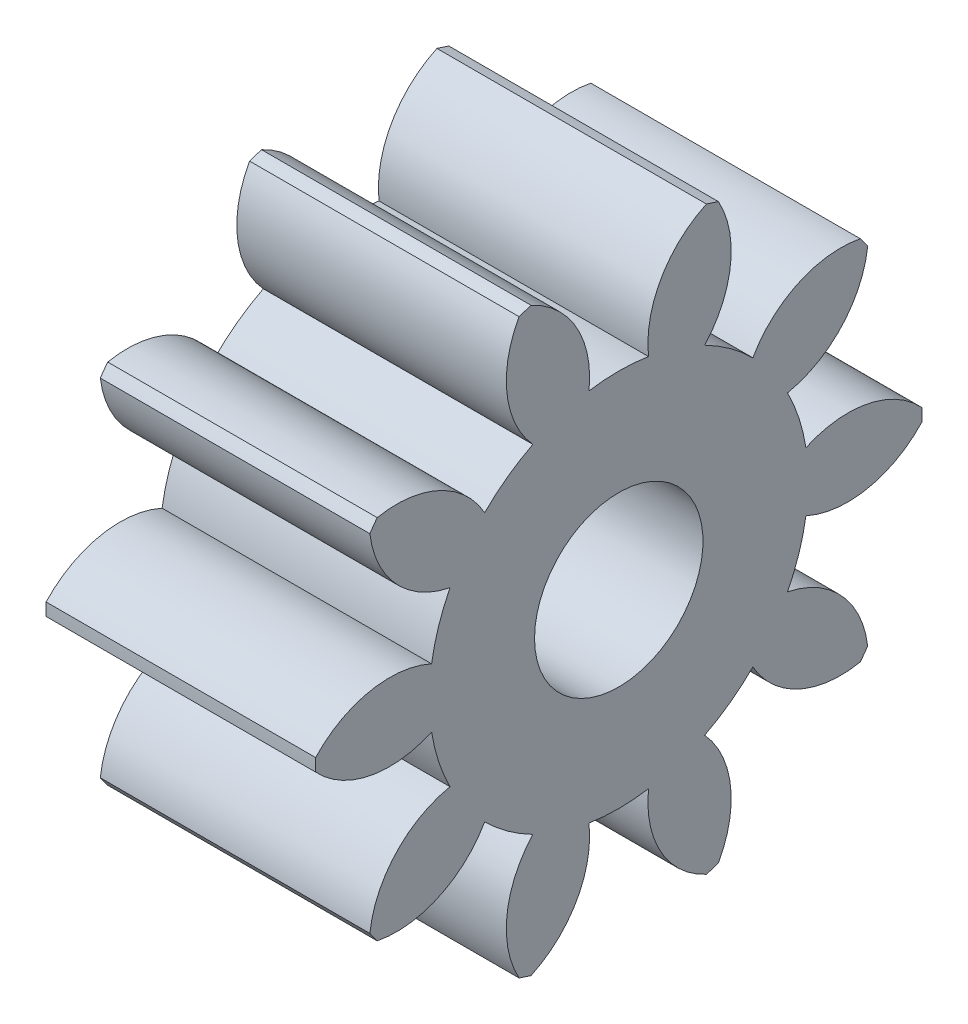
from build123d import *

# Parameters (mm, degrees)
BASPROSKE_W     = 8
BASPROSKE_H     = 9
TOOTHCUT_DEPTH  = 16.033296378
TEETHCUTS_COUNT = 10
TEETHCUTS_ANGLE = 324
BORSKE_R        = 2.5
BORE_DEPTH      = 50.0000508


with BuildPart() as part:
    # BasProSke → Base-Revolve (revolve)
    with BuildSketch(Plane(origin=(0, 0, 0), x_dir=(1, 0, 0), z_dir=(0, 1, 0)), mode=Mode.PRIVATE) as base_revolve_sk:
        with Locations((4, 4.5)):
            Rectangle(BASPROSKE_W, BASPROSKE_H)
    revolve(base_revolve_sk.sketch.rotate(Axis((-10, 0, 0), (1, 0, 0)), 180), axis=Axis((-10, 0, 0), (1, 0, 0)))

    # TooCutSke → ToothCut (cut, through all)
    with BuildSketch(Plane(origin=(0, 0, 0), x_dir=(0, 0, -1), z_dir=(1, 0, 0))):
        with BuildLine():
            ThreePointArc((0.883878355, 5.554109745), (0, 5.624), (-0.883878355, 5.554109745))
            ThreePointArc((-0.883878355, 5.554109745), (-1.258245767, 7.379188248), (-2.637816971, 8.631324741))
            ThreePointArc((-2.637816971, 8.631324741), (0, 9.0254), (2.637816971, 8.631324741))
            ThreePointArc((2.637816971, 8.631324741), (1.258245767, 7.379188248), (0.883878355, 5.554109745))
        make_face()
    toothcut = extrude(amount=TOOTHCUT_DEPTH, mode=Mode.SUBTRACT)

    # TeethCuts: ToothCut ×10 about axis
    teethcuts_axis = Axis((-10, 0, 0), (1, 0, 0))
    for i in range(1, TEETHCUTS_COUNT):
        add(toothcut.rotate(teethcuts_axis, i * TEETHCUTS_ANGLE / (TEETHCUTS_COUNT - 1)), mode=Mode.SUBTRACT)

    # BorSke → Bore (cut, symmetric)
    with BuildSketch(Plane(origin=(0, 0, 0), x_dir=(0, 0, -1), z_dir=(1, 0, 0))):
        with Locations(Location((0, 0, 0), (0, 0, 180))):
            Circle(BORSKE_R)
    extrude(amount=BORE_DEPTH, both=True, mode=Mode.SUBTRACT)


solid = part.part
